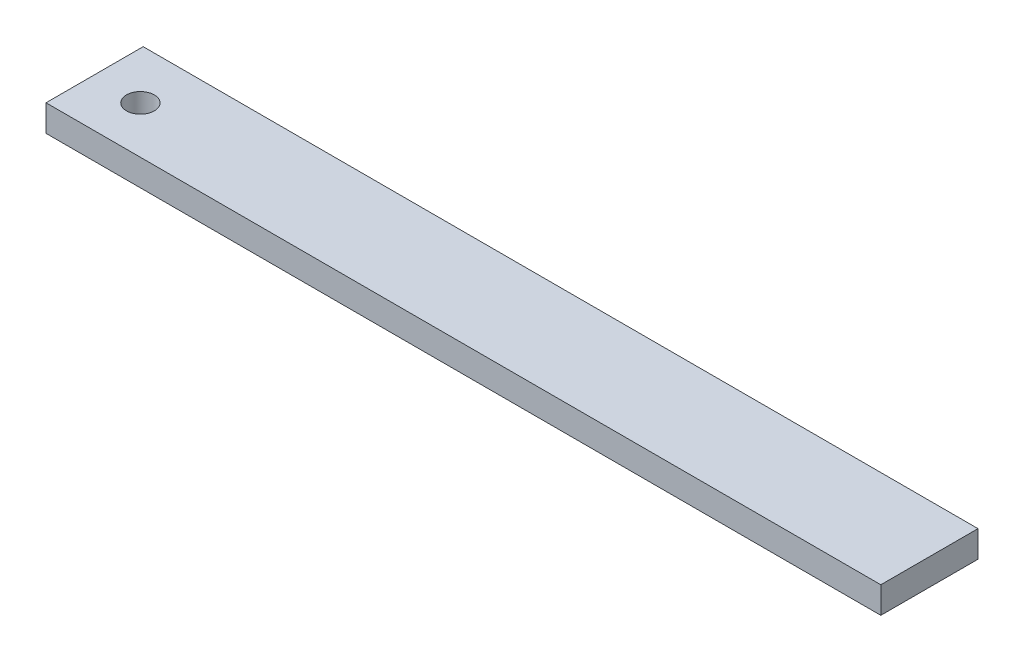
from build123d import *

# Parameters (mm, degrees)
SKETCH1_W           = 300
SKETCH1_H           = 34.925
SKETCH1_R           = 5
BOSS_EXTRUDE1_DEPTH = 9.525


with BuildPart() as part:
    # Sketch1 → Boss-Extrude1 (new body)
    with BuildSketch(Plane(origin=(0, 0, 0), x_dir=(1, 0, 0), z_dir=(0, 1, 0))):
        with Locations((-150, 17.4625)):
            Rectangle(SKETCH1_W, SKETCH1_H)
        with Locations(Location((-283, 16.925, 0), (0, 0, 90))):
            Circle(SKETCH1_R, mode=Mode.SUBTRACT)
    extrude(amount=BOSS_EXTRUDE1_DEPTH)


solid = part.part
